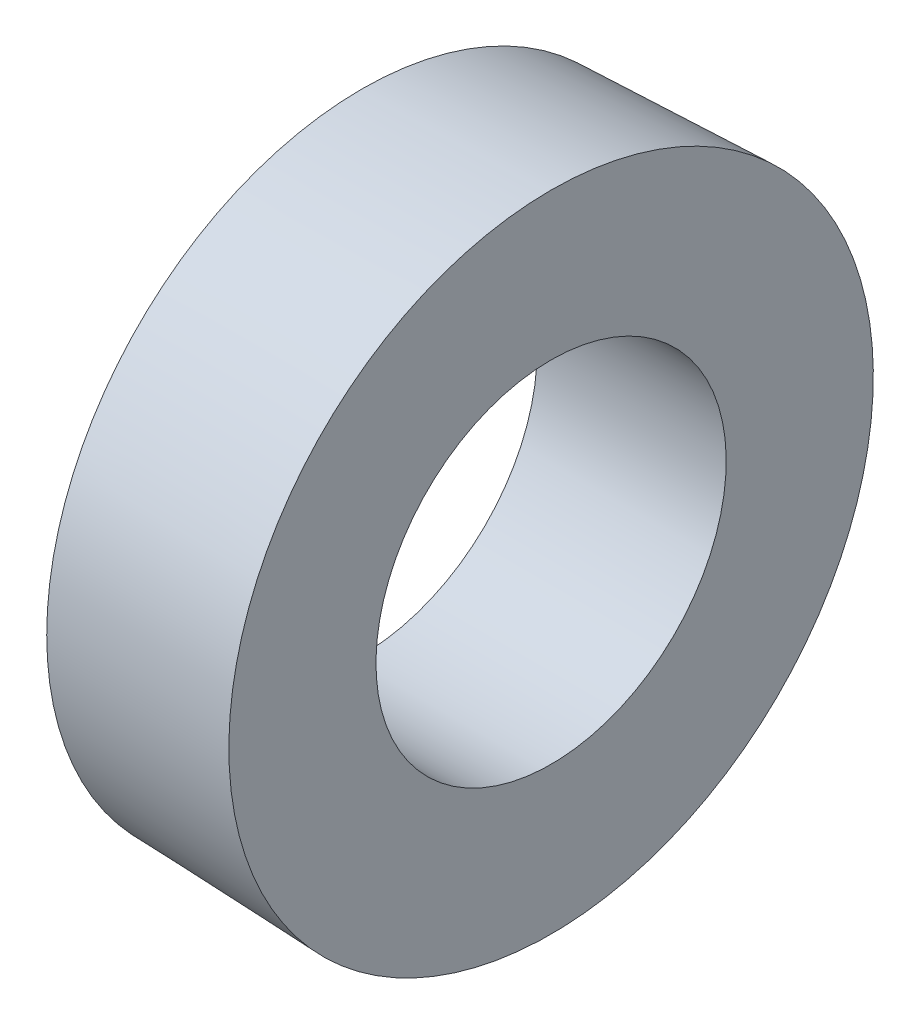
from build123d import *

# Parameters (mm, degrees)
REVOLVE1_ANGLE = 359.999999589


with BuildPart() as part:
    # Sketch1 → Revolve1 (revolve)
    with BuildSketch(Plane.XY):
        Polygon((4480, 250), (4480, 450), (4750, 460), (4750, 250), align=None)
    revolve(axis=Axis((0, 0, 0), (1, 0, 0)), revolution_arc=REVOLVE1_ANGLE)


solid = part.part
